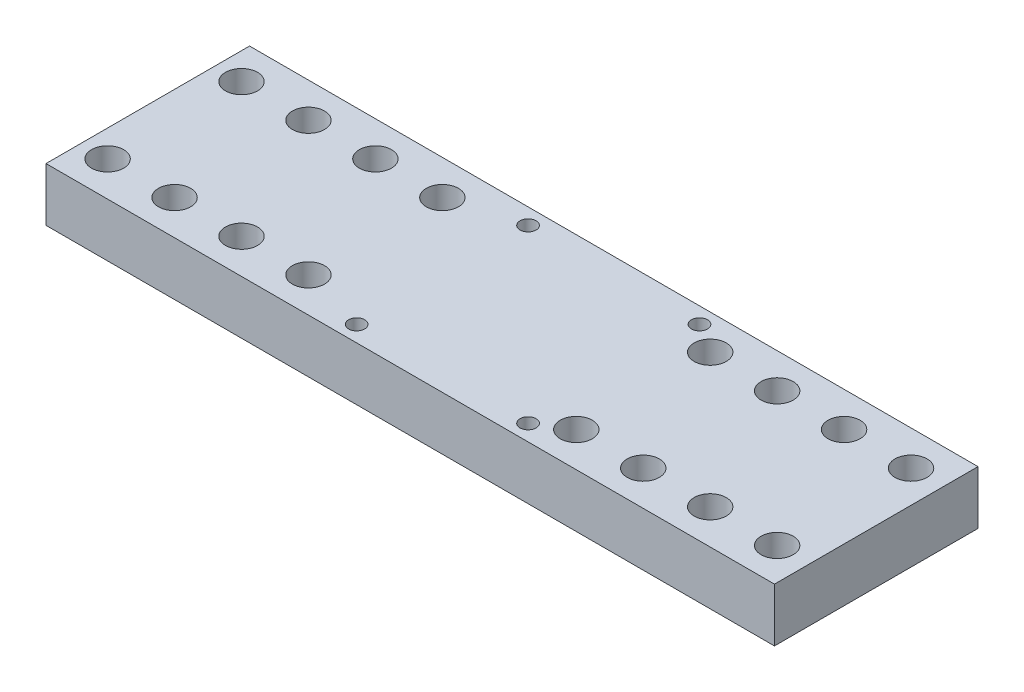
from build123d import *

# Parameters (mm, degrees)
SKETCH1_W           = 136
SKETCH1_H           = 38
SKETCH1_R           = 1.5
SKETCH1_R_2         = 3
BOSS_EXTRUDE1_DEPTH = 10


with BuildPart() as part:
    # Sketch1 → Boss-Extrude1 (new body)
    with BuildSketch(Plane(origin=(0, 0, 0), x_dir=(1, 0, 0), z_dir=(0, 1, 0))):
        with Locations((-2.969502184, -16.359463259)):
            Rectangle(SKETCH1_W, SKETCH1_H)
        with Locations(Location((-15.969502184, -0.359463259, 0), (0, 0, 270))):
            Circle(SKETCH1_R, mode=Mode.SUBTRACT)
        with Locations(Location((16.030497816, -0.359463259, 0), (0, 0, 270))):
            Circle(SKETCH1_R, mode=Mode.SUBTRACT)
        with Locations(Location((16.030497816, -32.359463259, 0), (0, 0, 270))):
            Circle(SKETCH1_R, mode=Mode.SUBTRACT)
        with Locations(Location((-15.969502184, -32.359463259, 0), (0, 0, 270))):
            Circle(SKETCH1_R, mode=Mode.SUBTRACT)
        with Locations(Location((-65.969502184, -3.859463259, 0), (0, 0, 270))):
            Circle(SKETCH1_R_2, mode=Mode.SUBTRACT)
        with Locations(Location((-40.969502184, -3.859463259, 0), (0, 0, 270))):
            Circle(SKETCH1_R_2, mode=Mode.SUBTRACT)
        with Locations(Location((-40.969502184, -28.859463259, 0), (0, 0, 270))):
            Circle(SKETCH1_R_2, mode=Mode.SUBTRACT)
        with Locations(Location((-65.969502184, -28.859463259, 0), (0, 0, 270))):
            Circle(SKETCH1_R_2, mode=Mode.SUBTRACT)
        with Locations(Location((-28.469502184, -28.859463259, 0), (0, 0, 270))):
            Circle(SKETCH1_R_2, mode=Mode.SUBTRACT)
        with Locations(Location((-53.469502184, -3.859463259, 0), (0, 0, 270))):
            Circle(SKETCH1_R_2, mode=Mode.SUBTRACT)
        with Locations(Location((-53.469502184, -28.859463259, 0), (0, 0, 270))):
            Circle(SKETCH1_R_2, mode=Mode.SUBTRACT)
        with Locations(Location((-28.469502184, -3.859463259, 0), (0, 0, 270))):
            Circle(SKETCH1_R_2, mode=Mode.SUBTRACT)
        with Locations(Location((34.030497816, -3.859463259, 0), (0, 0, 270))):
            Circle(SKETCH1_R_2, mode=Mode.SUBTRACT)
        with Locations(Location((59.030497816, -28.859463259, 0), (0, 0, 270))):
            Circle(SKETCH1_R_2, mode=Mode.SUBTRACT)
        with Locations(Location((59.030497816, -3.859463259, 0), (0, 0, 270))):
            Circle(SKETCH1_R_2, mode=Mode.SUBTRACT)
        with Locations(Location((34.030497816, -28.859463259, 0), (0, 0, 270))):
            Circle(SKETCH1_R_2, mode=Mode.SUBTRACT)
        with Locations(Location((21.530497816, -28.859463259, 0), (0, 0, 270))):
            Circle(SKETCH1_R_2, mode=Mode.SUBTRACT)
        with Locations(Location((46.530497816, -28.859463259, 0), (0, 0, 270))):
            Circle(SKETCH1_R_2, mode=Mode.SUBTRACT)
        with Locations(Location((21.530497816, -3.859463259, 0), (0, 0, 270))):
            Circle(SKETCH1_R_2, mode=Mode.SUBTRACT)
        with Locations(Location((46.530497816, -3.859463259, 0), (0, 0, 270))):
            Circle(SKETCH1_R_2, mode=Mode.SUBTRACT)
    extrude(amount=BOSS_EXTRUDE1_DEPTH)


solid = part.part
